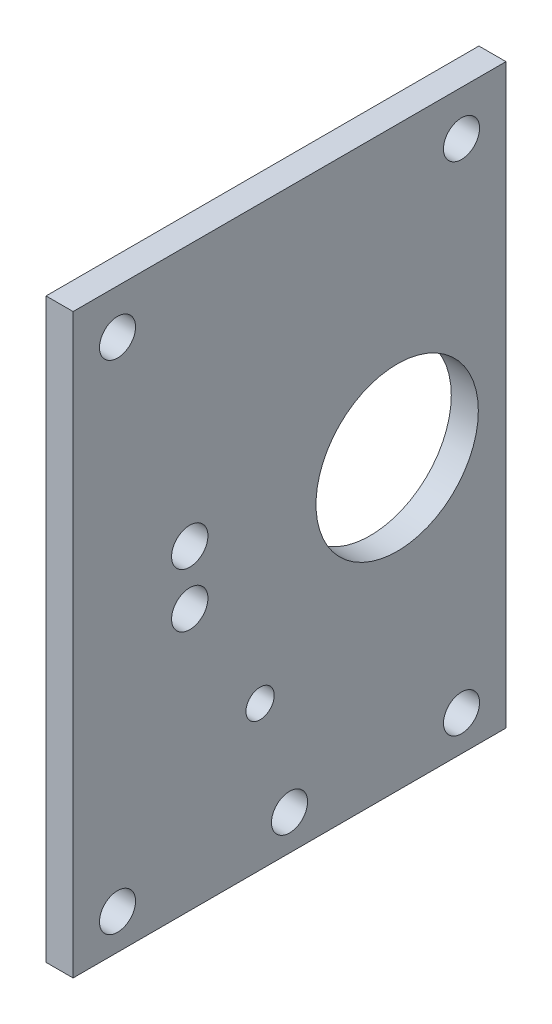
from build123d import *

# Parameters (mm, degrees)
SKETCH2_W            = 76.2
SKETCH2_H            = 101.6
BOSS_EXTRUDE1_DEPTH  = 4.7625
SKETCH3_R            = 3.175
CUT_EXTRUDE1_DEPTH   = 6.35
SKETCH3_4_R          = 3.175
SKETCH3_4_R_2        = 14.2875
SKETCH3_4_R_3        = 2.4892
CUT_EXTRUDE2_DEPTH   = 6.35
M6_CLEARANCE_HOLE1_D = 6.4


with BuildPart() as part:
    # Sketch2 → Boss-Extrude1 (new body)
    with BuildSketch(Plane(origin=(0, 0, 0), x_dir=(0, 0, -1), z_dir=(1, 0, 0))):
        Rectangle(SKETCH2_W, SKETCH2_H)
    extrude(amount=BOSS_EXTRUDE1_DEPTH)

    # Sketch3 → Cut-Extrude1 (cut)
    with BuildSketch(Plane(origin=(4.7625, 0, 0), x_dir=(0, 0, -1), z_dir=(1, 0, 0))):
        with Locations((30.2768, 42.9768)):
            Circle(SKETCH3_R)
    extrude(amount=-CUT_EXTRUDE1_DEPTH, mode=Mode.SUBTRACT)

    # Sketch3<4> → Cut-Extrude2 (cut)
    with BuildSketch(Plane(origin=(4.7625, 0, 0), x_dir=(0, 0, -1), z_dir=(1, 0, 0))):
        with Locations((30.2768, -44.5643)):
            Circle(SKETCH3_4_R)
        with Locations((30.2768, 42.9768)):
            Circle(SKETCH3_4_R)
        with Locations((-30.2768, 42.9768)):
            Circle(SKETCH3_4_R)
        with Locations((-30.2768, -44.5643)):
            Circle(SKETCH3_4_R)
        with Locations((18.9484, 0)):
            Circle(SKETCH3_4_R_2)
        with Locations((-5.1816, -25.4)):
            Circle(SKETCH3_4_R_3)
        with Locations((0, -44.5643)):
            Circle(SKETCH3_4_R)
    extrude(amount=-CUT_EXTRUDE2_DEPTH, mode=Mode.SUBTRACT)

    # M6 Clearance Hole1 (through all)
    with Locations(Plane(origin=(4.7625, 0, 0), x_dir=(0, 0, -1), z_dir=(1, 0, 0))):
        with Locations((-17.5641, -4.7625), (-17.5641, 4.7625)):
            Hole(M6_CLEARANCE_HOLE1_D / 2)


solid = part.part
